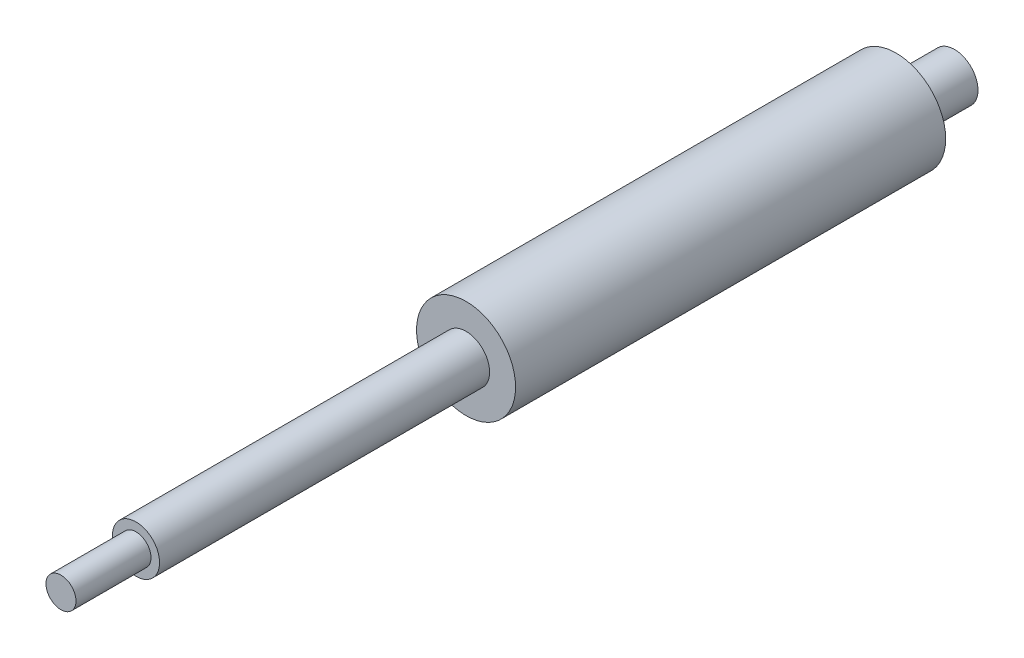
from build123d import *

# Parameters (mm, degrees)
SKETCH1_R                = 9.9
BOSS_EXTRUDE1_DEPTH      = 86
BOSS_EXTRUDE3_DEPTH      = 66
BOSS_EXTRUDE3_DEPTH_BACK = 97.65
SKETCH3_R                = 4.7125
BOSS_EXTRUDE2_START      = 66
SKETCH2_R                = 3
BOSS_EXTRUDE2_DEPTH      = 15


with BuildPart() as part:
    # Sketch1 → Boss-Extrude1 (new body)
    with BuildSketch(Plane.XY):
        Circle(SKETCH1_R)
    extrude(amount=BOSS_EXTRUDE1_DEPTH)

    # Sketch3 → Boss-Extrude3 (add, two sides: drawn at the far end of the back side and taken through both)
    with BuildSketch(Plane.XY.offset(86).offset(-BOSS_EXTRUDE3_DEPTH_BACK)):
        Circle(SKETCH3_R)
    extrude(amount=BOSS_EXTRUDE3_DEPTH + BOSS_EXTRUDE3_DEPTH_BACK)

    # Sketch2 → Boss-Extrude2 (add)
    with BuildSketch(Plane.XY.offset(86).offset(BOSS_EXTRUDE2_START)):
        Circle(SKETCH2_R)
    extrude(amount=BOSS_EXTRUDE2_DEPTH)


solid = part.part
